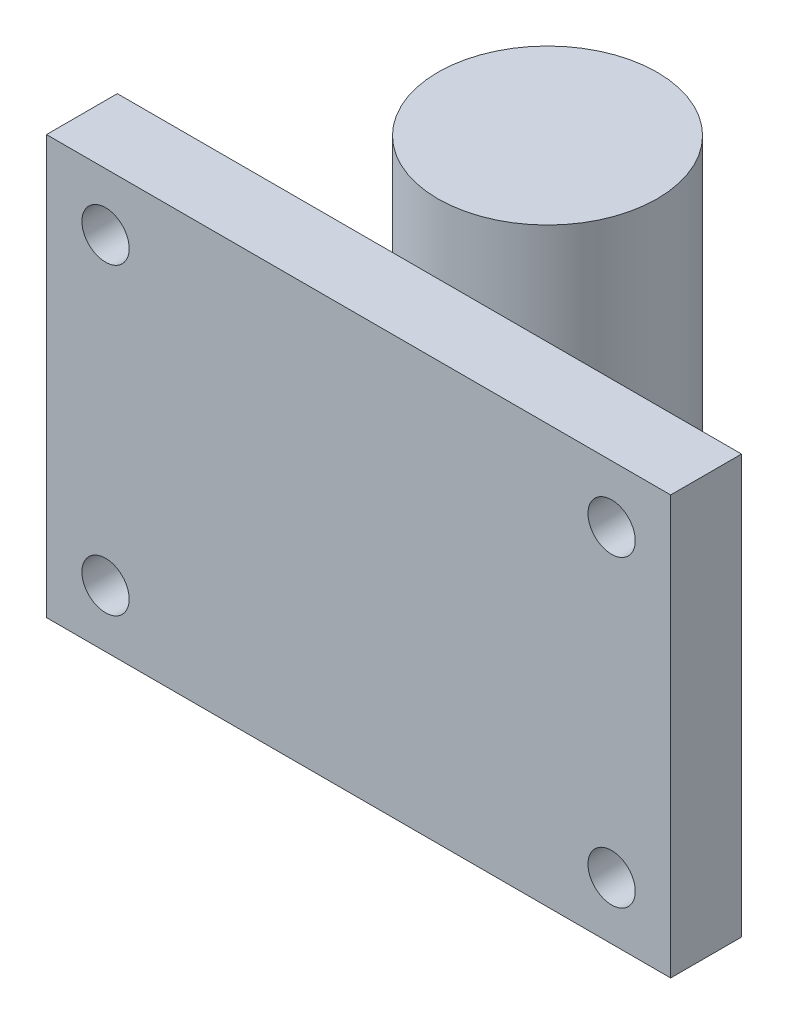
from build123d import *

# Parameters (mm, degrees)
SKETCH_1_W          = 185
SKETCH_1_H          = 124
EXTRUDE_1_DEPTH     = 21
EXTRUDE_2_DEPTH     = 15
SKETCH_5_R          = 32.5
EXTRUDE_3_DEPTH     = 80
SKETCH_6_R          = 7
CUT_EXTRUDE_1_DEPTH = 140.687150447


with BuildPart() as part:
    # 草图1 → 凸台-拉伸1 (new body)
    with BuildSketch(Plane.XY):
        Rectangle(SKETCH_1_W, SKETCH_1_H)
    extrude(amount=EXTRUDE_1_DEPTH)

    # 草图3 → 凸台-拉伸2 (add, symmetric)
    with BuildSketch(Plane(origin=(0, 0, 0), x_dir=(1, 0, 0), z_dir=(0, 1, 0))):
        with BuildLine():
            Line((40, 0), (-40, 0))
            ThreePointArc((-40, 0), (-26.459601843, 16.925451065), (-19.835033499, 37.563483197))
            ThreePointArc((-19.835033499, 37.563483197), (0, 15), (19.835033499, 37.563483197))
            ThreePointArc((19.835033499, 37.563483197), (26.459601843, 16.925451065), (40, 0))
        make_face()
    extrude(amount=EXTRUDE_2_DEPTH, both=True)

    # 草图5 → 凸台-拉伸3 (add, symmetric)
    with BuildSketch(Plane(origin=(0, 0, 0), x_dir=(1, 0, 0), z_dir=(0, 1, 0))):
        with Locations(Location((0, 35, 0), (0, 0, 270))):
            Circle(SKETCH_5_R)
    extrude(amount=EXTRUDE_3_DEPTH, both=True)

    # 草图6 → 切除-拉伸1 (cut, through all)
    with BuildSketch(Plane(origin=(0, 0, 0), x_dir=(-1, 0, 0), z_dir=(0, 0, -1))):
        with Locations((-75, 45)):
            Circle(SKETCH_6_R)
        with Locations((75, 45)):
            Circle(SKETCH_6_R)
        with Locations((75, -45)):
            Circle(SKETCH_6_R)
        with Locations((-75, -45)):
            Circle(SKETCH_6_R)
    extrude(amount=-CUT_EXTRUDE_1_DEPTH, mode=Mode.SUBTRACT)


solid = part.part
